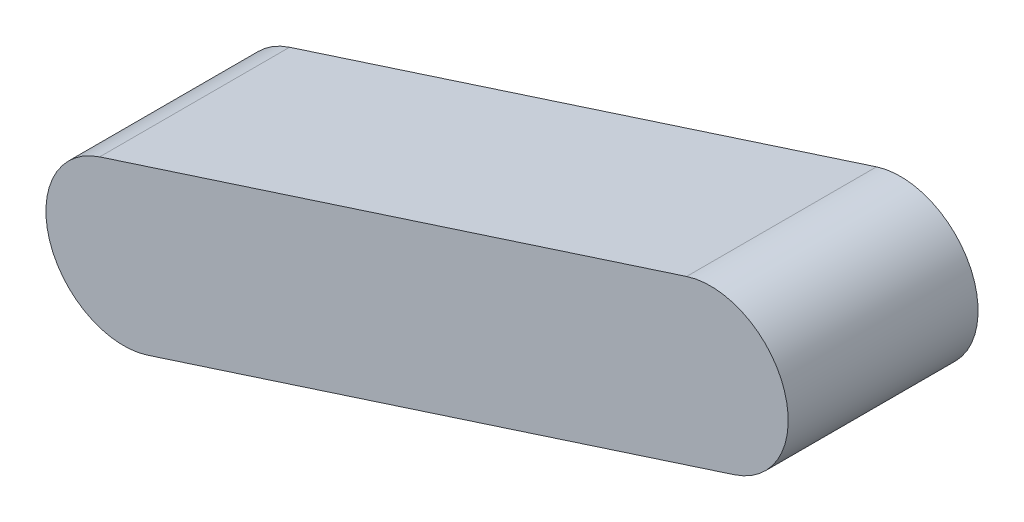
from build123d import *

# Parameters (mm, degrees)
BOSS_EXTRUDE1_DEPTH = 11


with BuildPart() as part:
    # Sketch1 → Boss-Extrude1 (new body)
    with BuildSketch(Plane.XY):
        with BuildLine():
            Line((4.385191284, 0.718499667), (38.385191284, 11.718499667))
            ThreePointArc((38.385191284, 11.718499667), (41.281500333, 17.385191284), (35.614808716, 20.281500333))
            Line((35.614808716, 20.281500333), (1.614808716, 9.281500333))
            ThreePointArc((1.614808716, 9.281500333), (-1.281500333, 3.614808716), (4.385191284, 0.718499667))
        make_face()
    extrude(amount=BOSS_EXTRUDE1_DEPTH)


solid = part.part
